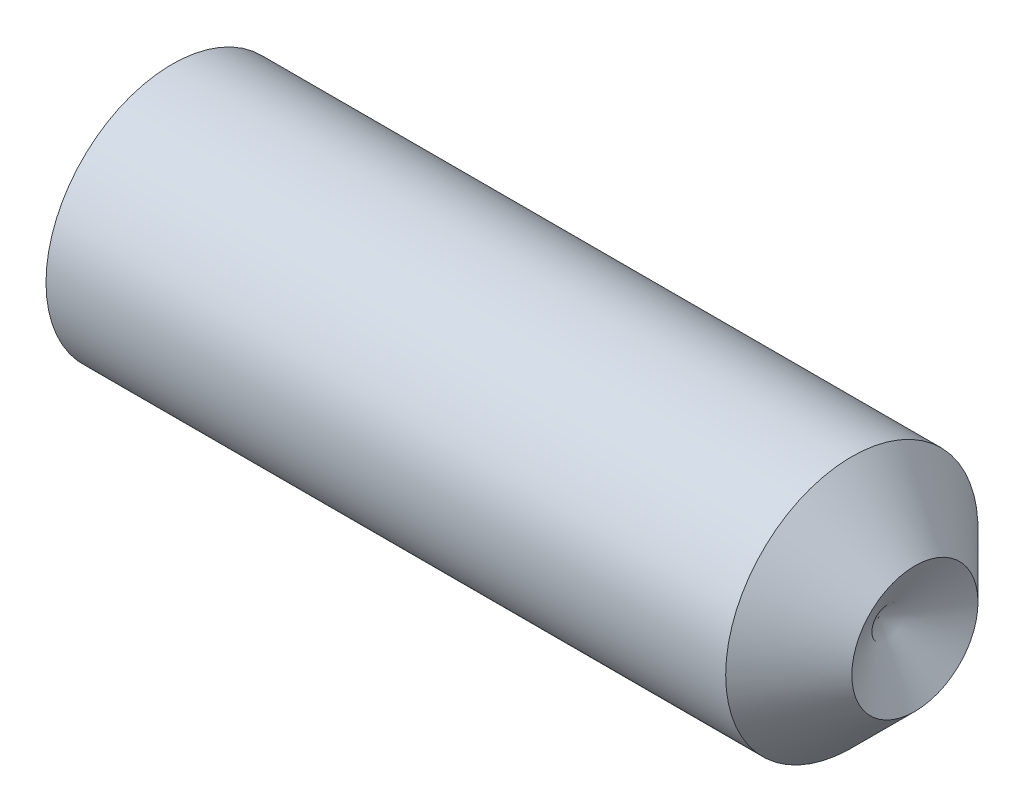
from build123d import *

# Parameters (mm, degrees)
HEX_2_DEPTH = 2.5


with BuildPart() as part:
    # BodySke → BaseBody (revolve)
    with BuildSketch(Plane.XY, mode=Mode.PRIVATE) as basebody_sk:
        Polygon((0, 0), (0, 1.61), (0.225166605, 2), (11, 2), (12, 1), (11.422649731, 0), align=None)
    revolve(basebody_sk.sketch.rotate(Axis((-12.7, 0, 0), (1, 0, 0)), 90), axis=Axis((-12.7, 0, 0), (1, 0, 0)))

    # Sketch2 → Hex 2 (cut)
    with BuildSketch(Plane.ZY):
        Polygon((0.577350269, 1), (-0.577350269, 1), (-1.154700538, 0), (-0.577350269, -1), (0.577350269, -1), (1.154700538, 0), align=None)
    extrude(amount=-HEX_2_DEPTH, mode=Mode.SUBTRACT)


solid = part.part
